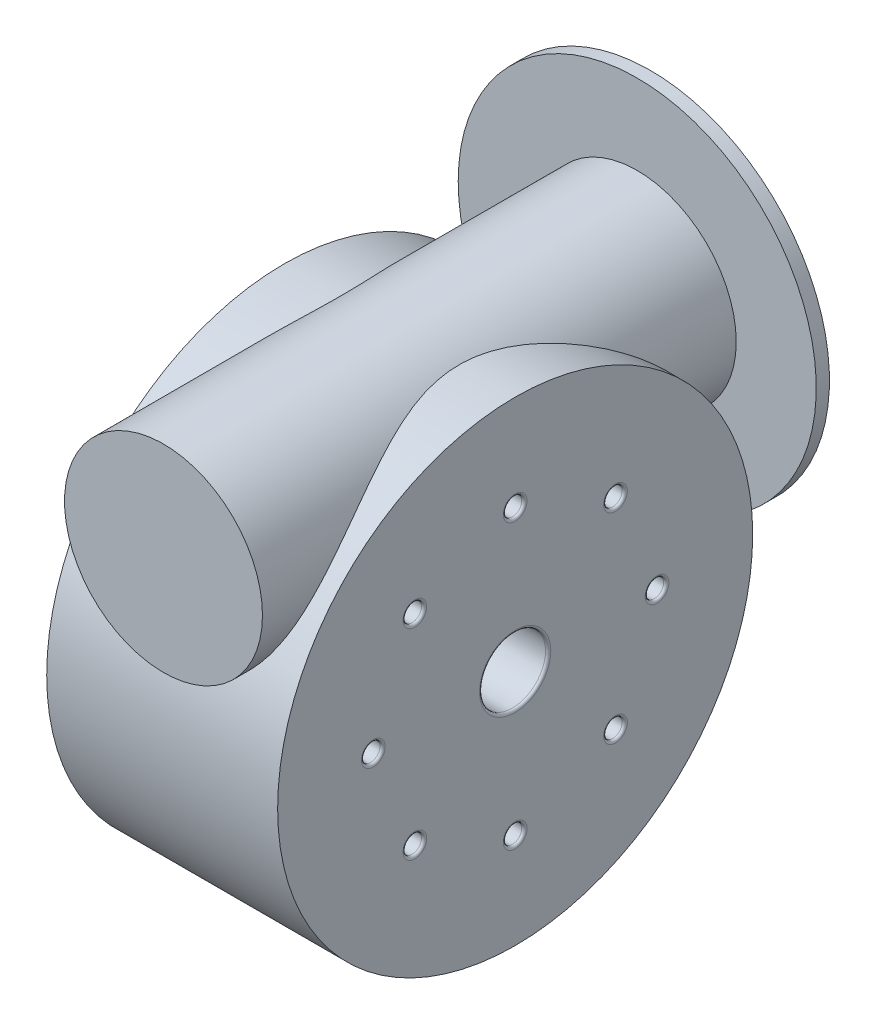
from build123d import *

# Parameters (mm, degrees)
SKETCH1_R                = 180
BOSS_EXTRUDE1_DEPTH      = 87.5
SKETCH2_R                = 7
CUT_EXTRUDE1_DEPTH       = 309.909371823
FILLET1_R                = 2
CIRPATTERN1_COUNT        = 8
FILLET1_OF_CIRPATTERN1_R = 2
SKETCH3_R                = 25
CUT_EXTRUDE2_DEPTH       = 314.533341464
FILLET2_R                = 2
BOSS_EXTRUDE2_DEPTH      = 179
BOSS_EXTRUDE2_DEPTH_BACK = 190
SKETCH5_R                = 75
SKETCH6_R                = 135.668206722
BOSS_EXTRUDE3_DEPTH      = 10


with BuildPart() as part:
    # Sketch1 → Boss-Extrude1 (new, symmetric)
    with BuildSketch(Plane(origin=(0, 0, 0), x_dir=(0, 0, -1), z_dir=(1, 0, 0))):
        Circle(SKETCH1_R)
    extrude(amount=BOSS_EXTRUDE1_DEPTH, both=True)

    # Sketch2 → Cut-Extrude1 (cut, through all)
    with BuildSketch(Plane.ZY.offset(87.5)):
        with Locations((0, 107.5)):
            Circle(SKETCH2_R)
    cut_extrude1 = extrude(amount=-CUT_EXTRUDE1_DEPTH, mode=Mode.SUBTRACT)

    # Fillet1
    fillet1_edges = [part.edges().sort_by_distance(p)[0] for p in [
        (87.5, 107.5, -7),
        (-87.5, 107.5, -7),
    ]]
    fillet(fillet1_edges, radius=FILLET1_R)

    # CirPattern1: Cut-Extrude1 ×8 about axis
    cirpattern1_axis = Axis((0, 0, 0), (1, 0, 0))
    for i in range(1, CIRPATTERN1_COUNT):
        add(cut_extrude1.rotate(cirpattern1_axis, i * 360 / CIRPATTERN1_COUNT), mode=Mode.SUBTRACT)

    # Fillet1 of CirPattern1
    fillet1_of_cirpattern1_edges = [part.edges().sort_by_distance(p)[0] for p in [
        (87.5, 80.963726446, 71.064231509),
        (-87.5, 80.963726446, 71.064231509),
        (87.5, 7, 107.5),
        (-87.5, 7, 107.5),
        (87.5, -71.064231509, 80.963726446),
        (-87.5, -71.064231509, 80.963726446),
        (87.5, -107.5, 7),
        (-87.5, -107.5, 7),
        (87.5, -80.963726446, -71.064231509),
        (-87.5, -80.963726446, -71.064231509),
        (87.5, -7, -107.5),
        (-87.5, -7, -107.5),
        (87.5, 71.064231509, -80.963726446),
        (-87.5, 71.064231509, -80.963726446),
    ]]
    fillet(fillet1_of_cirpattern1_edges, radius=FILLET1_OF_CIRPATTERN1_R)

    # Sketch3 → Cut-Extrude2 (cut)
    with BuildSketch(Plane(origin=(87.5, 0, 0), x_dir=(0, 0, -1), z_dir=(1, 0, 0))):
        Circle(SKETCH3_R)
    extrude(amount=-CUT_EXTRUDE2_DEPTH, mode=Mode.SUBTRACT)

    # Fillet2
    fillet2_edges = [part.edges().sort_by_distance(p)[0] for p in [
        (-87.5, 0, 25),
        (87.5, 0, 25),
    ]]
    fillet(fillet2_edges, radius=FILLET2_R)

    # Sketch5 → Boss-Extrude2 (add, two sides: drawn at the far end of the back side and taken through both)
    with BuildSketch(Plane.XY.offset(-BOSS_EXTRUDE2_DEPTH_BACK)):
        with Locations((0, 120)):
            Circle(SKETCH5_R)
    extrude(amount=BOSS_EXTRUDE2_DEPTH + BOSS_EXTRUDE2_DEPTH_BACK)


with BuildPart() as body_2:
    # Sketch6 → Boss-Extrude3 (new body)
    with BuildSketch(Plane(origin=(0, 0, -190), x_dir=(-1, 0, 0), z_dir=(0, 0, -1))):
        with Locations((0, 120)):
            Circle(SKETCH6_R)
    extrude(amount=-BOSS_EXTRUDE3_DEPTH)


solid = Compound([part.part, body_2.part])
